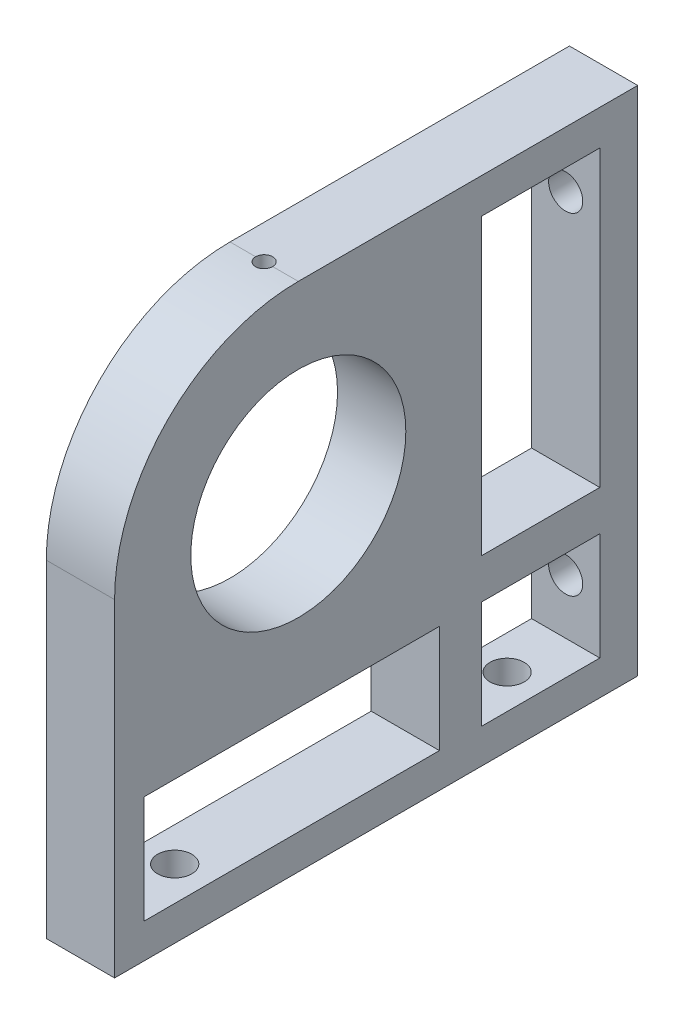
from build123d import *

# Parameters (mm, degrees)
SKETCH1_R           = 20
BOSS_EXTRUDE1_DEPTH = 12.7
SKETCH2_R           = 1.5875
CUT_EXTRUDE1_DEPTH  = 89.674827911
SKETCH3_W           = 21.981677087
SKETCH3_H           = 54.692506085
SKETCH3_W_2         = 54.954192717
SKETCH3_H_2         = 20.019027347
CUT_EXTRUDE2_DEPTH  = 70.866
SKETCH4_R           = 3.175
CUT_EXTRUDE3_DEPTH  = 13.462
SKETCH5_R           = 3.175
CUT_EXTRUDE4_DEPTH  = 13.462


with BuildPart() as part:
    # Sketch1 → Boss-Extrude1 (new body)
    with BuildSketch(Plane(origin=(0, 0, 0), x_dir=(0, 0, -1), z_dir=(1, 0, 0))):
        with BuildLine():
            Line((0, 34.177299494), (34.177299494, 34.177299494))
            Line((34.177299494, 34.177299494), (63.133299494, 34.177299494))
            Line((63.133299494, 34.177299494), (63.133299494, -60.96))
            Line((63.133299494, -60.96), (-34.177299494, -60.96))
            Line((-34.177299494, -60.96), (-34.177299494, 0))
            ThreePointArc((-34.177299494, 0), (-24.167000235, 24.167000235), (0, 34.177299494))
        make_face()
        Circle(SKETCH1_R, mode=Mode.SUBTRACT)
    extrude(amount=BOSS_EXTRUDE1_DEPTH)

    # Sketch2 → Cut-Extrude1 (cut, through all)
    with BuildSketch(Plane(origin=(0, 0, 0), x_dir=(1, 0, 0), z_dir=(0, 1, 0))):
        with Locations(Location((6.35, 0, 0), (0, 0, 90))):
            Circle(SKETCH2_R)
    extrude(amount=CUT_EXTRUDE1_DEPTH, mode=Mode.SUBTRACT)

    # Sketch3 → Cut-Extrude2 (cut)
    with BuildSketch(Plane.ZY):
        with Locations((-45.095335943, 0.281776268)):
            Rectangle(SKETCH3_W, SKETCH3_H)
        with Locations((1.22319792, -44.53205946)):
            Rectangle(SKETCH3_W_2, SKETCH3_H_2)
        with Locations((-45.095335943, -44.53205946)):
            Rectangle(SKETCH3_W, SKETCH3_H_2)
    extrude(amount=-CUT_EXTRUDE2_DEPTH, mode=Mode.SUBTRACT)

    # Sketch4 → Cut-Extrude3 (cut)
    with BuildSketch(Plane.XZ.offset(60.96)):
        with Locations(Location((6.35, 16.646444295, 0), (0, 0, 270))):
            Circle(SKETCH4_R)
        with Locations(Location((6.35, -45.192507654, 0), (0, 0, 270))):
            Circle(SKETCH4_R)
    extrude(amount=-CUT_EXTRUDE3_DEPTH, mode=Mode.SUBTRACT)

    # Sketch5 → Cut-Extrude4 (cut)
    with BuildSketch(Plane(origin=(0, 0, -63.133299494), x_dir=(-1, 0, 0), z_dir=(0, 0, -1))):
        with Locations((-6.35, 17.445139987)):
            Circle(SKETCH5_R)
        with Locations((-6.35, -44.233190942)):
            Circle(SKETCH5_R)
    extrude(amount=-CUT_EXTRUDE4_DEPTH, mode=Mode.SUBTRACT)


solid = part.part
